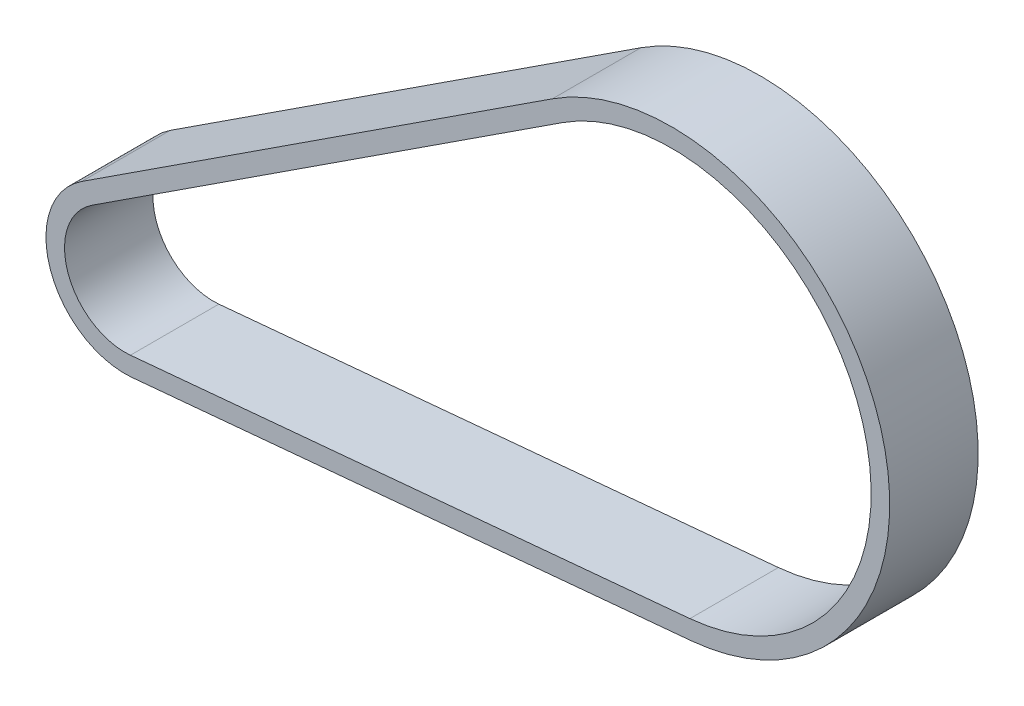
from build123d import *

# Parameters (mm, degrees)
EXTRUS_O_FINA1_DEPTH = 9.53


with BuildPart() as part:
    # Esboço2 → Extrusão-Fina1 (new body)
    with BuildSketch(Plane.XY):
        with BuildLine():
            Line((-63.542787432, -13.379991232), (-12.835941724, 19.684730124))
            ThreePointArc((-12.835941724, 19.684730124), (22.194149255, 7.724619011), (2.159781023, -23.400541573))
            Line((2.159781023, -23.400541573), (-58.118802609, -28.964025676))
            ThreePointArc((-58.118802609, -28.964025676), (-66.927671007, -23.294011131), (-63.542787432, -13.379991232))
        make_face()
        with BuildLine():
            Line((-62.45036686, -15.055287412), (-11.743521152, 18.009433943))
            ThreePointArc((-11.743521152, 18.009433943), (20.305285488, 7.067204627), (1.975969872, -21.40900612))
            Line((1.975969872, -21.40900612), (-58.30261376, -26.972490222))
            ThreePointArc((-58.30261376, -26.972490222), (-65.038807241, -22.636596748), (-62.45036686, -15.055287412))
        make_face(mode=Mode.SUBTRACT)
    extrude(amount=EXTRUS_O_FINA1_DEPTH)


solid = part.part
